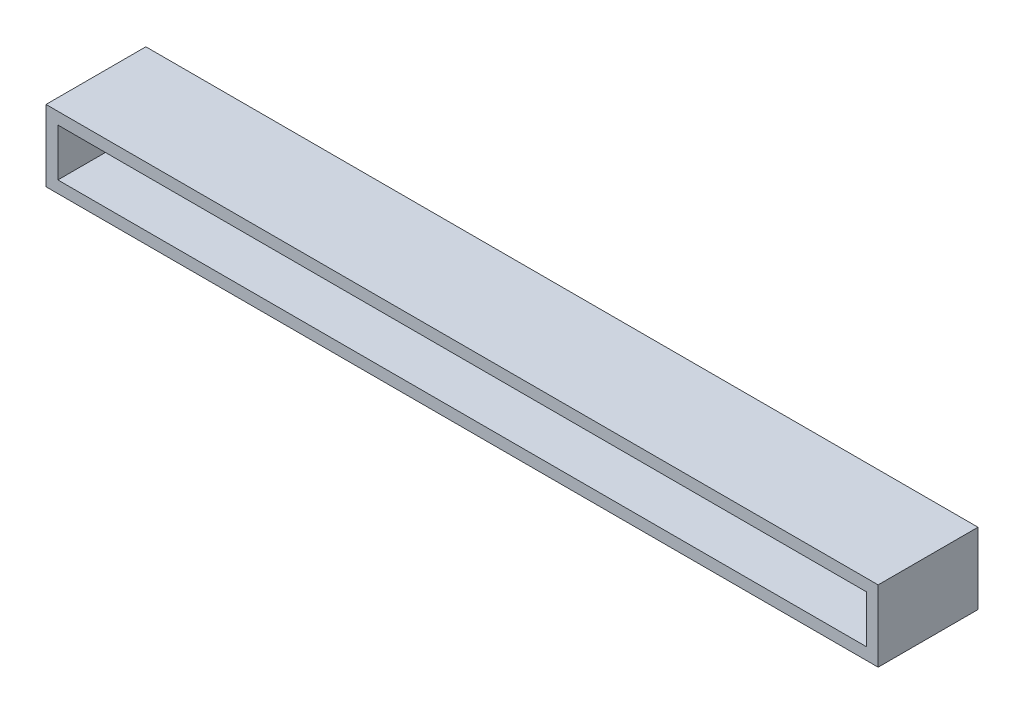
from build123d import *

# Parameters (mm, degrees)
SKETCH1_W           = 177.8
SKETCH1_H           = 15.24
BOSS_EXTRUDE1_DEPTH = 2.54
SKETCH2_W           = 177.8
SKETCH2_H           = 15.24
SKETCH2_W_2         = 172.72
SKETCH2_H_2         = 10.16
BOSS_EXTRUDE2_DEPTH = 18.796


with BuildPart() as part:
    # Sketch1 → Boss-Extrude1 (new body)
    with BuildSketch(Plane.XY):
        with Locations((88.9, 7.62)):
            Rectangle(SKETCH1_W, SKETCH1_H)
    extrude(amount=BOSS_EXTRUDE1_DEPTH)

    # Sketch2 → Boss-Extrude2 (add)
    with BuildSketch(Plane.XY.offset(2.54)):
        with Locations((88.9, 7.62)):
            Rectangle(SKETCH2_W, SKETCH2_H)
        with Locations((88.9, 7.62)):
            Rectangle(SKETCH2_W_2, SKETCH2_H_2, mode=Mode.SUBTRACT)
    extrude(amount=BOSS_EXTRUDE2_DEPTH)


solid = part.part
